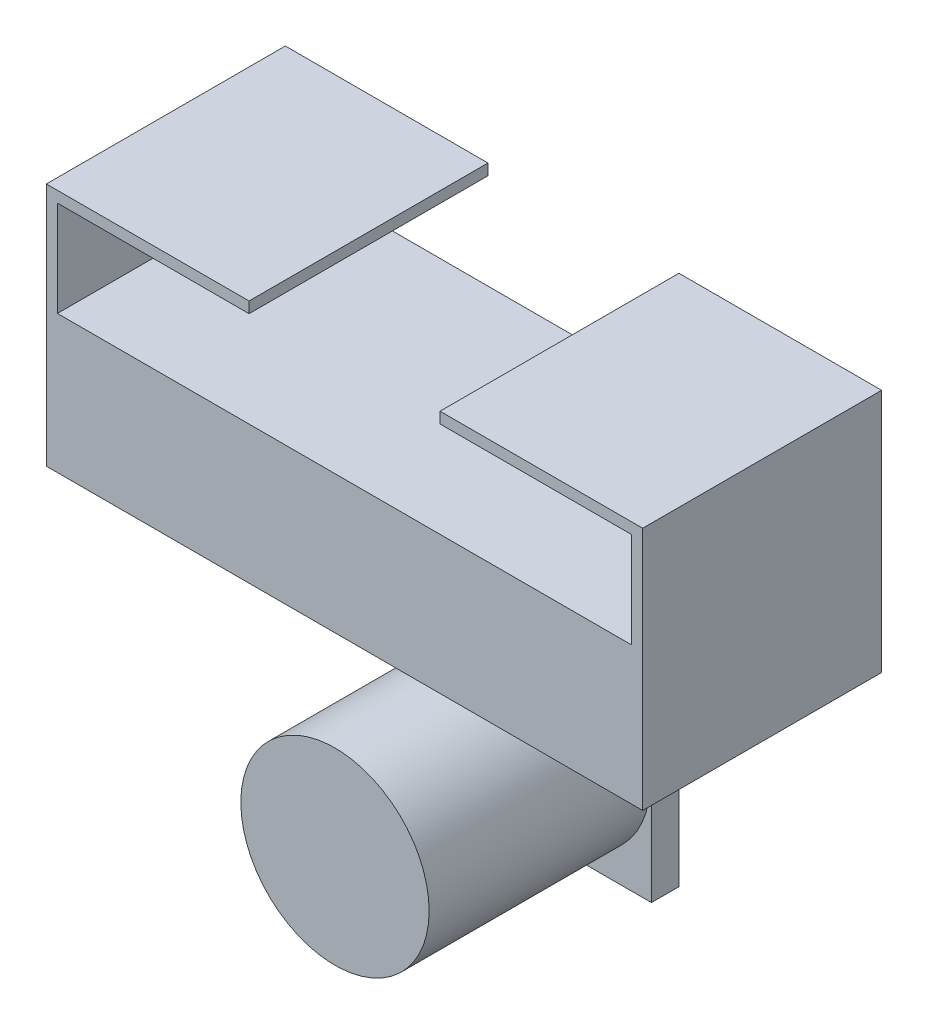
from build123d import *

# Parameters (mm, degrees)
SKETCH1_R           = 12.512434662
BOSS_EXTRUDE1_DEPTH = 33.02
SKETCH9_W           = 25.4
SKETCH9_H           = 38.1
BOSS_EXTRUDE2_DEPTH = 3.66776
SKETCH10_W          = 76.3016
SKETCH10_H          = 31.75
BOSS_EXTRUDE3_DEPTH = 18.316200479
SKETCH13_W          = 1.467555556
SKETCH13_H          = 32.483304479
BOSS_EXTRUDE4_DEPTH = 31.75
SKETCH14_W          = 25.4635
SKETCH14_H          = 31.75
BOSS_EXTRUDE5_DEPTH = 1.467104


with BuildPart() as part:
    # Sketch1 → Boss-Extrude1 (new body)
    with BuildSketch(Plane.XY):
        Circle(SKETCH1_R)
    extrude(amount=BOSS_EXTRUDE1_DEPTH)

    # Sketch9 → Boss-Extrude2 (add)
    with BuildSketch(Plane(origin=(0, 0, 0), x_dir=(-1, 0, 0), z_dir=(0, 0, -1))):
        with Locations((0, 5.434708389)):
            Rectangle(SKETCH9_W, SKETCH9_H)
    extrude(amount=-BOSS_EXTRUDE2_DEPTH)

    # Sketch10 → Boss-Extrude3 (add)
    with BuildSketch(Plane(origin=(0, 24.484708389, 0), x_dir=(1, 0, 0), z_dir=(0, 1, 0))):
        with Locations((0, -15.875)):
            Rectangle(SKETCH10_W, SKETCH10_H)
    extrude(amount=BOSS_EXTRUDE3_DEPTH)

    # Sketch13 → Boss-Extrude4 (add)
    with BuildSketch(Plane.XY.offset(31.75)):
        with Locations((-38.884577778, 40.726360629)):
            Rectangle(SKETCH13_W, SKETCH13_H)
        with Locations((38.884577778, 40.726360629)):
            Rectangle(SKETCH13_W, SKETCH13_H)
    extrude(amount=-BOSS_EXTRUDE4_DEPTH)

    # Sketch14 → Boss-Extrude5 (add)
    with BuildSketch(Plane(origin=(0, 56.968012868, 0), x_dir=(1, 0, 0), z_dir=(0, 1, 0))):
        with Locations((-25.41905, -15.875)):
            Rectangle(SKETCH14_W, SKETCH14_H)
        with Locations((25.41905, -15.875)):
            Rectangle(SKETCH14_W, SKETCH14_H)
    extrude(amount=-BOSS_EXTRUDE5_DEPTH)


solid = part.part
